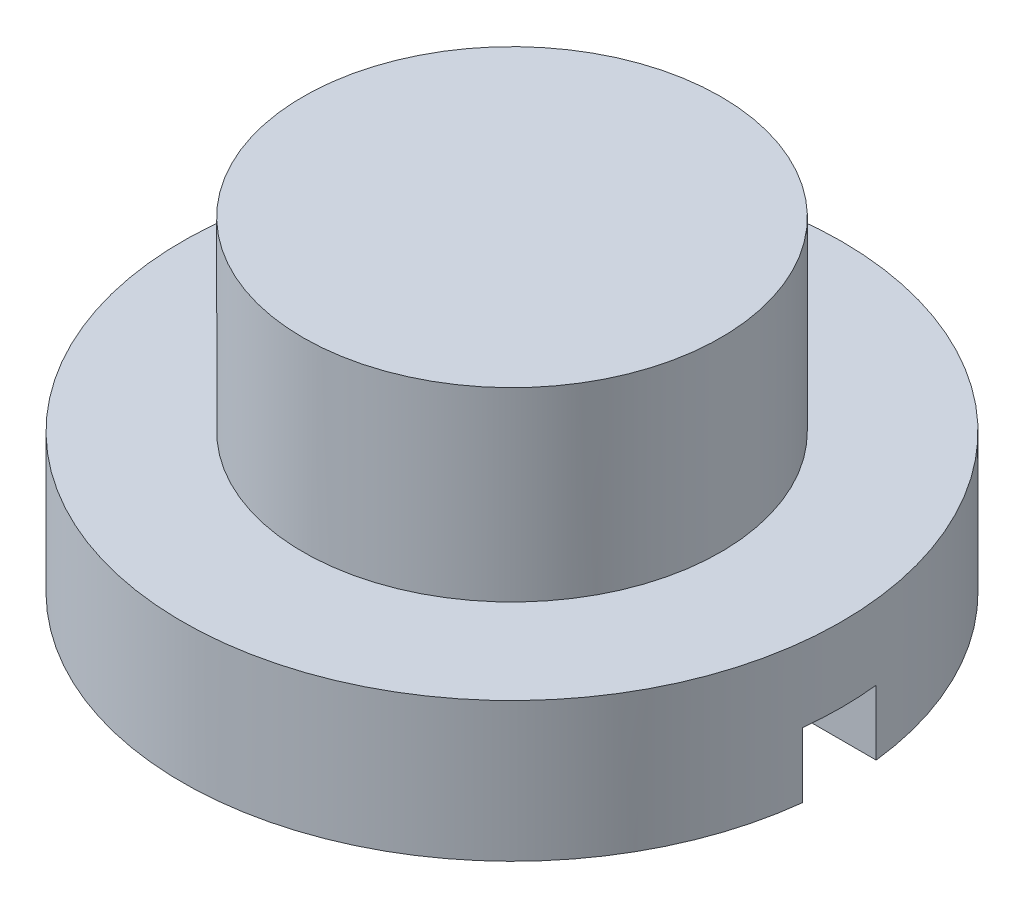
from build123d import *

# Parameters (mm, degrees)
SKETCH1_R           = 5.715
BOSS_EXTRUDE1_DEPTH = 5.08
SKETCH2_R           = 9.017
BOSS_EXTRUDE2_DEPTH = 3.81
SKETCH3_W           = 18.688246184
SKETCH3_H           = 2.010717395
CUT_EXTRUDE1_DEPTH  = 1.778


with BuildPart() as part:
    # Sketch1 → Boss-Extrude1 (new body)
    with BuildSketch(Plane(origin=(0, 0, 0), x_dir=(1, 0, 0), z_dir=(0, 1, 0))):
        with Locations(Location((-11.700574837, 6.278703551, 0), (0, 0, 270))):
            Circle(SKETCH1_R)
    extrude(amount=BOSS_EXTRUDE1_DEPTH)

    # Sketch2 → Boss-Extrude2 (add)
    with BuildSketch(Plane.XZ):
        with Locations(Location((-11.700574837, -6.278703551, 0), (0, 0, 90))):
            Circle(SKETCH2_R)
    extrude(amount=BOSS_EXTRUDE2_DEPTH)

    # Sketch3 → Cut-Extrude1 (cut)
    with BuildSketch(Plane.XZ.offset(3.81)):
        with Locations((-11.700574837, -6.278703552)):
            Rectangle(SKETCH3_W, SKETCH3_H)
    extrude(amount=-CUT_EXTRUDE1_DEPTH, mode=Mode.SUBTRACT)


solid = part.part
